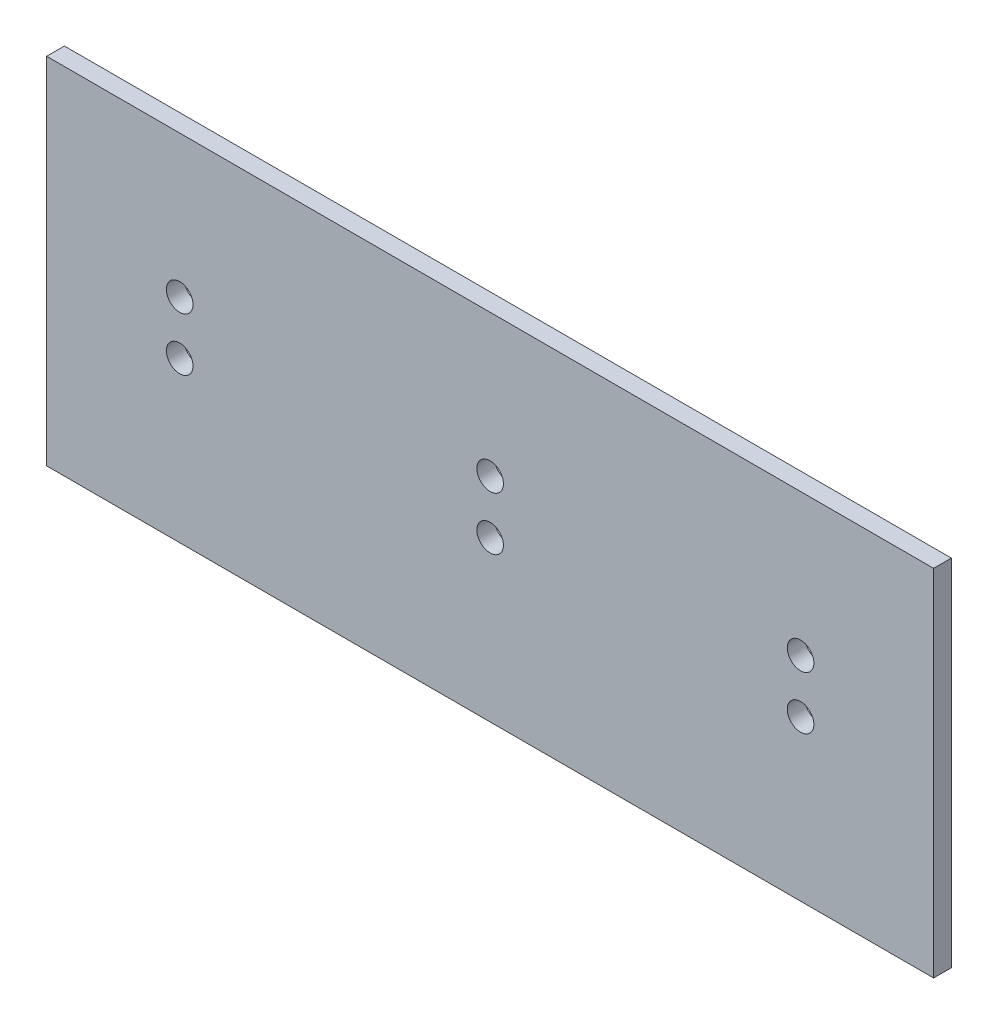
from build123d import *

# Parameters (mm, degrees)
SKETCH1_W           = 100
SKETCH1_H           = 40
SKETCH1_R           = 1.5
BOSS_EXTRUDE1_DEPTH = 2


with BuildPart() as part:
    # Sketch1 → Boss-Extrude1 (new body)
    with BuildSketch(Plane.XY):
        Rectangle(SKETCH1_W, SKETCH1_H)
        with Locations((-35, -2)):
            Circle(SKETCH1_R, mode=Mode.SUBTRACT)
        with Locations(Location((35, 4, 0), (0, 0, 180))):
            Circle(SKETCH1_R, mode=Mode.SUBTRACT)
        with Locations((0, 4)):
            Circle(SKETCH1_R, mode=Mode.SUBTRACT)
        with Locations((-35, 4)):
            Circle(SKETCH1_R, mode=Mode.SUBTRACT)
        with Locations(Location((35, -2, 0), (0, 0, 180))):
            Circle(SKETCH1_R, mode=Mode.SUBTRACT)
        with Locations((0, -2)):
            Circle(SKETCH1_R, mode=Mode.SUBTRACT)
    extrude(amount=BOSS_EXTRUDE1_DEPTH)


solid = part.part
